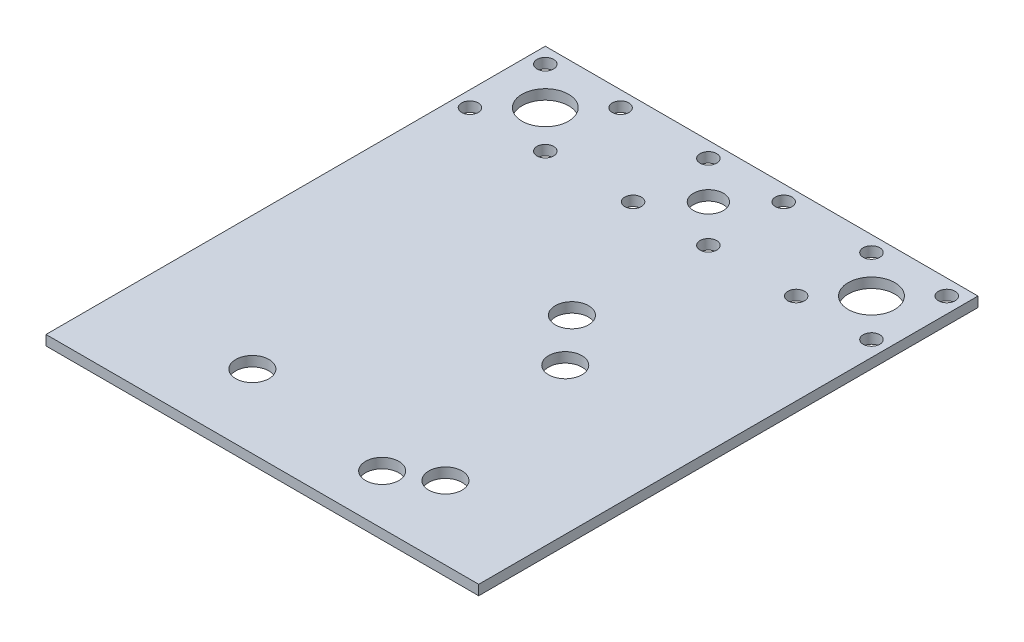
from build123d import *

# Parameters (mm, degrees)
SKETCH1_W                  = 130
SKETCH1_H                  = 150
BOSS_EXTRUDE1_DEPTH        = 3
F_10_0_10_DIAMETER_HOLE2_D = 10
F_14_0_14_DIAMETER_HOLE1_D = 14
F_5_0_5_DIAMETER_HOLE1_D   = 5
F_10_0_10_DIAMETER_HOLE1_D = 10
F_9_0_9_DIAMETER_HOLE1_D   = 9
F_5_0_5_DIAMETER_HOLE2_D   = 5


with BuildPart() as part:
    # Sketch1 → Boss-Extrude1 (new body)
    with BuildSketch(Plane(origin=(0, 0, 0), x_dir=(1, 0, 0), z_dir=(0, 1, 0))):
        with Locations((65, -75)):
            Rectangle(SKETCH1_W, SKETCH1_H)
    extrude(amount=BOSS_EXTRUDE1_DEPTH)

    # Ø10.0 (10) Diameter Hole2 (through all)
    with Locations(Plane(origin=(0, 3, 0), x_dir=(1, 0, 0), z_dir=(0, 1, 0))):
        with Locations((98, -128), (40, -128), (74, -66)):
            Hole(F_10_0_10_DIAMETER_HOLE2_D / 2)

    # Ø14.0 (14) Diameter Hole1 (through all)
    with Locations(Plane(origin=(0, 3, 0), x_dir=(1, 0, 0), z_dir=(0, 1, 0))):
        with Locations((16, -16), (114, -16)):
            Hole(F_14_0_14_DIAMETER_HOLE1_D / 2)

    # Ø5.0 (5) Diameter Hole1 (through all)
    with Locations(Plane(origin=(0, 3, 0), x_dir=(1, 0, 0), z_dir=(0, 1, 0))):
        with Locations((4.686291501, -27.313708499), (4.686291501, -4.686291501), (27.313708499, -4.686291501), (27.313708499, -27.313708499), (102.686291501, -27.313708499), (125.313708499, -27.313708499), (125.313708499, -4.686291501), (102.686291501, -4.686291501)):
            Hole(F_5_0_5_DIAMETER_HOLE1_D / 2)

    # Ø10.0 (10) Diameter Hole1 (through all)
    with Locations(Plane(origin=(0, 3, 0), x_dir=(1, 0, 0), z_dir=(0, 1, 0))):
        with Locations((86, -80), (86, -135)):
            Hole(F_10_0_10_DIAMETER_HOLE1_D / 2)

    # Ø9.0 (9) Diameter Hole1 (through all)
    with Locations(Plane(origin=(0, 3, 0), x_dir=(1, 0, 0), z_dir=(0, 1, 0))):
        with Locations((65, -16)):
            Hole(F_9_0_9_DIAMETER_HOLE1_D / 2)

    # Ø5.0 (5) Diameter Hole2 (through all)
    with Locations(Plane(origin=(0, 3, 0), x_dir=(1, 0, 0), z_dir=(0, 1, 0))):
        with Locations((53.686291501, -27.313708499), (76.313708499, -27.313708499), (76.313708499, -4.686291501), (53.686291501, -4.686291501)):
            Hole(F_5_0_5_DIAMETER_HOLE2_D / 2)


solid = part.part
